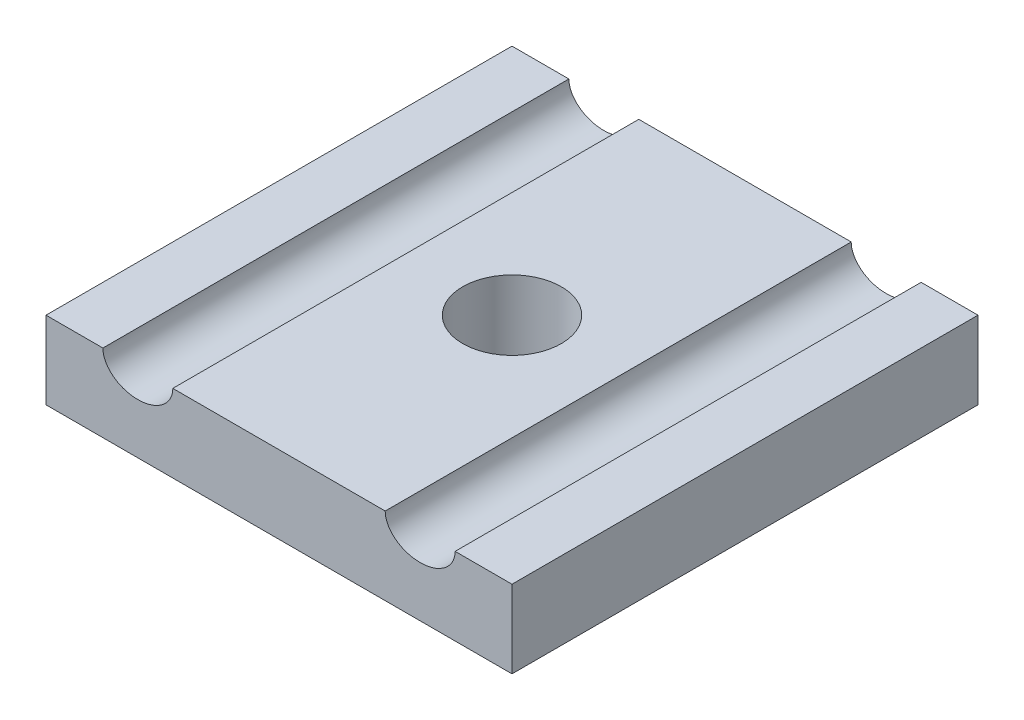
from build123d import *

# Parameters (mm, degrees)
SKETCH1_W           = 30
SKETCH1_H           = 30
BOSS_EXTRUDE1_DEPTH = 5
SKETCH2_R           = 3.175
CUT_EXTRUDE1_DEPTH  = 5
SKETCH3_RX          = 2.25
SKETCH3_RY          = 1.75
CUT_EXTRUDE3_DEPTH  = 30


with BuildPart() as part:
    # Sketch1 → Boss-Extrude1 (new body)
    with BuildSketch(Plane(origin=(0, 0, 0), x_dir=(1, 0, 0), z_dir=(0, 1, 0))):
        with Locations((-15, -15)):
            Rectangle(SKETCH1_W, SKETCH1_H)
    extrude(amount=BOSS_EXTRUDE1_DEPTH)

    # Sketch2 → Cut-Extrude1 (cut)
    with BuildSketch(Plane(origin=(0, 5, 0), x_dir=(1, 0, 0), z_dir=(0, 1, 0))):
        with Locations(Location((-15, -15, 0), (0, 0, 270))):
            Circle(SKETCH2_R)
    extrude(amount=-CUT_EXTRUDE1_DEPTH, mode=Mode.SUBTRACT)

    # Sketch3 → Cut-Extrude3 (cut)
    with BuildSketch(Plane.XY.offset(30)):
        with Locations(Location((-24.0875, 5), (0, 0, 180))):
            Ellipse(SKETCH3_RX, SKETCH3_RY)
        with Locations(Location((-5.9125, 5), (0, 0, 180))):
            Ellipse(SKETCH3_RX, SKETCH3_RY)
    extrude(amount=-CUT_EXTRUDE3_DEPTH, mode=Mode.SUBTRACT)


solid = part.part
